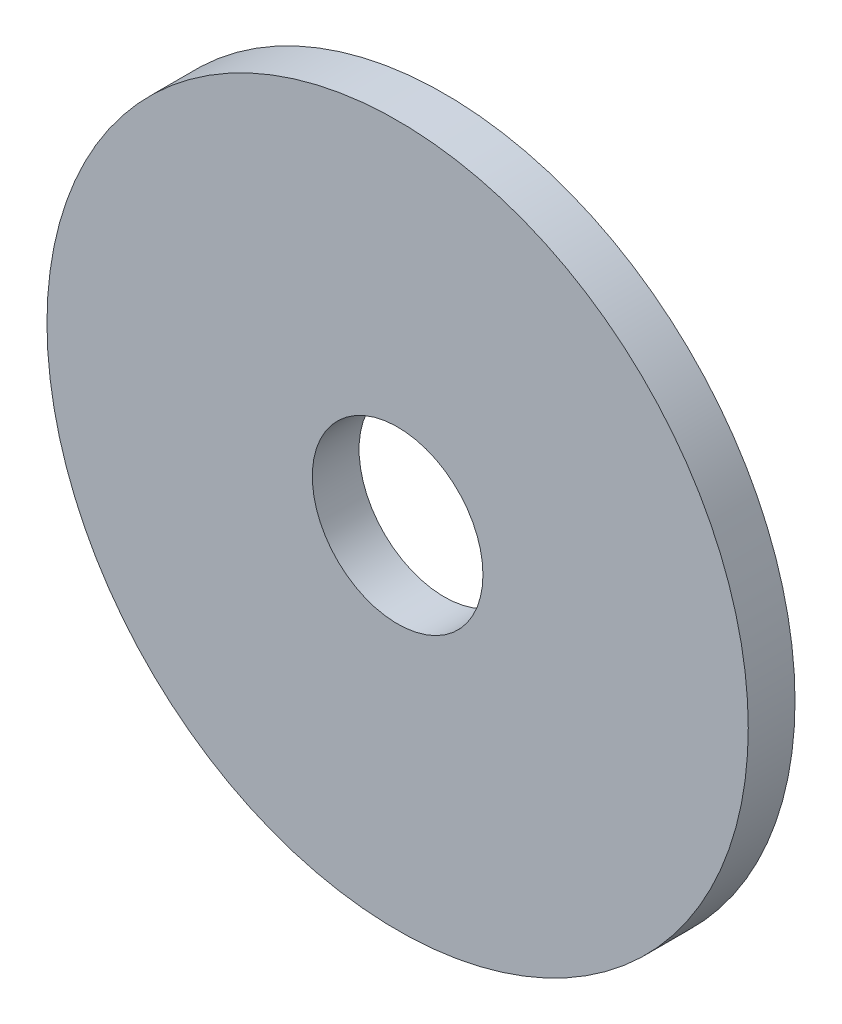
from build123d import *

# Parameters (mm, degrees)
CROQUIS1_R              = 15
CROQUIS1_R_2            = 3.65
SALIENTE_EXTRUIR1_DEPTH = 1


with BuildPart() as part:
    # Croquis1 → Saliente-Extruir1 (new, symmetric)
    with BuildSketch(Plane.XY):
        Circle(CROQUIS1_R)
        Circle(CROQUIS1_R_2, mode=Mode.SUBTRACT)
    extrude(amount=SALIENTE_EXTRUIR1_DEPTH, both=True)


solid = part.part
